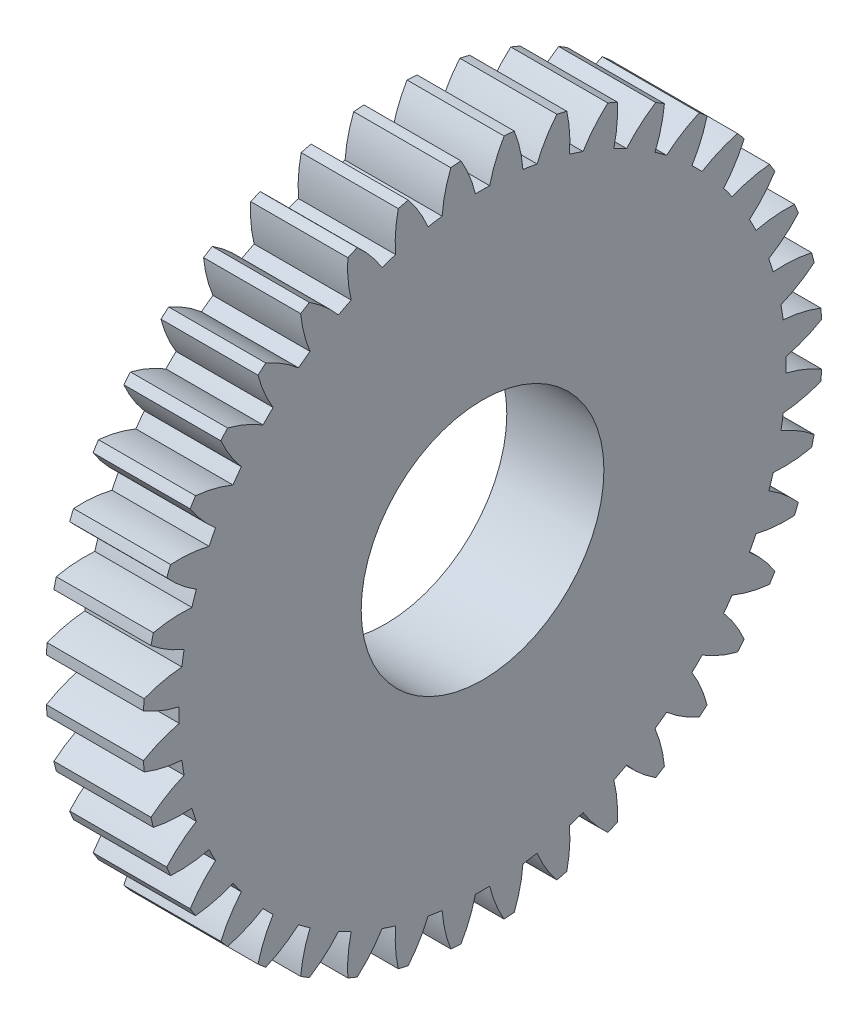
from build123d import *

# Parameters (mm, degrees)
BASPROSKE_W     = 12
BASPROSKE_H     = 42
TOOTHCUT_DEPTH  = 61.59702963
TEETHCUTS_COUNT = 40
TEETHCUTS_ANGLE = 351
BORSKE_R        = 15
BORE_DEPTH      = 50.0000508


with BuildPart() as part:
    # BasProSke → Base-Revolve (revolve)
    with BuildSketch(Plane(origin=(0, 0, 0), x_dir=(1, 0, 0), z_dir=(0, 1, 0)), mode=Mode.PRIVATE) as base_revolve_sk:
        with Locations((6, 21)):
            Rectangle(BASPROSKE_W, BASPROSKE_H)
    revolve(base_revolve_sk.sketch.rotate(Axis((-10, 0, 0), (1, 0, 0)), 180), axis=Axis((-10, 0, 0), (1, 0, 0)))

    # TooCutSke → ToothCut (cut, through all)
    with BuildSketch(Plane(origin=(0, 0, 0), x_dir=(0, 0, -1), z_dir=(1, 0, 0))):
        with BuildLine():
            ThreePointArc((0.882812088, 37.488606854), (0, 37.499), (-0.882812088, 37.488606854))
            ThreePointArc((-0.882812088, 37.488606854), (-1.612748684, 39.782000434), (-2.678427154, 41.939960338))
            ThreePointArc((-2.678427154, 41.939960338), (0, 42.0254), (2.678427154, 41.939960338))
            ThreePointArc((2.678427154, 41.939960338), (1.612748684, 39.782000434), (0.882812088, 37.488606854))
        make_face()
    toothcut = extrude(amount=TOOTHCUT_DEPTH, mode=Mode.SUBTRACT)

    # TeethCuts: ToothCut ×40 about axis
    teethcuts_axis = Axis((-10, 0, 0), (1, 0, 0))
    for i in range(1, TEETHCUTS_COUNT):
        add(toothcut.rotate(teethcuts_axis, i * TEETHCUTS_ANGLE / (TEETHCUTS_COUNT - 1)), mode=Mode.SUBTRACT)

    # BorSke → Bore (cut, symmetric)
    with BuildSketch(Plane(origin=(0, 0, 0), x_dir=(0, 0, -1), z_dir=(1, 0, 0))):
        with Locations(Location((0, 0, 0), (0, 0, 180))):
            Circle(BORSKE_R)
    extrude(amount=BORE_DEPTH, both=True, mode=Mode.SUBTRACT)


solid = part.part
